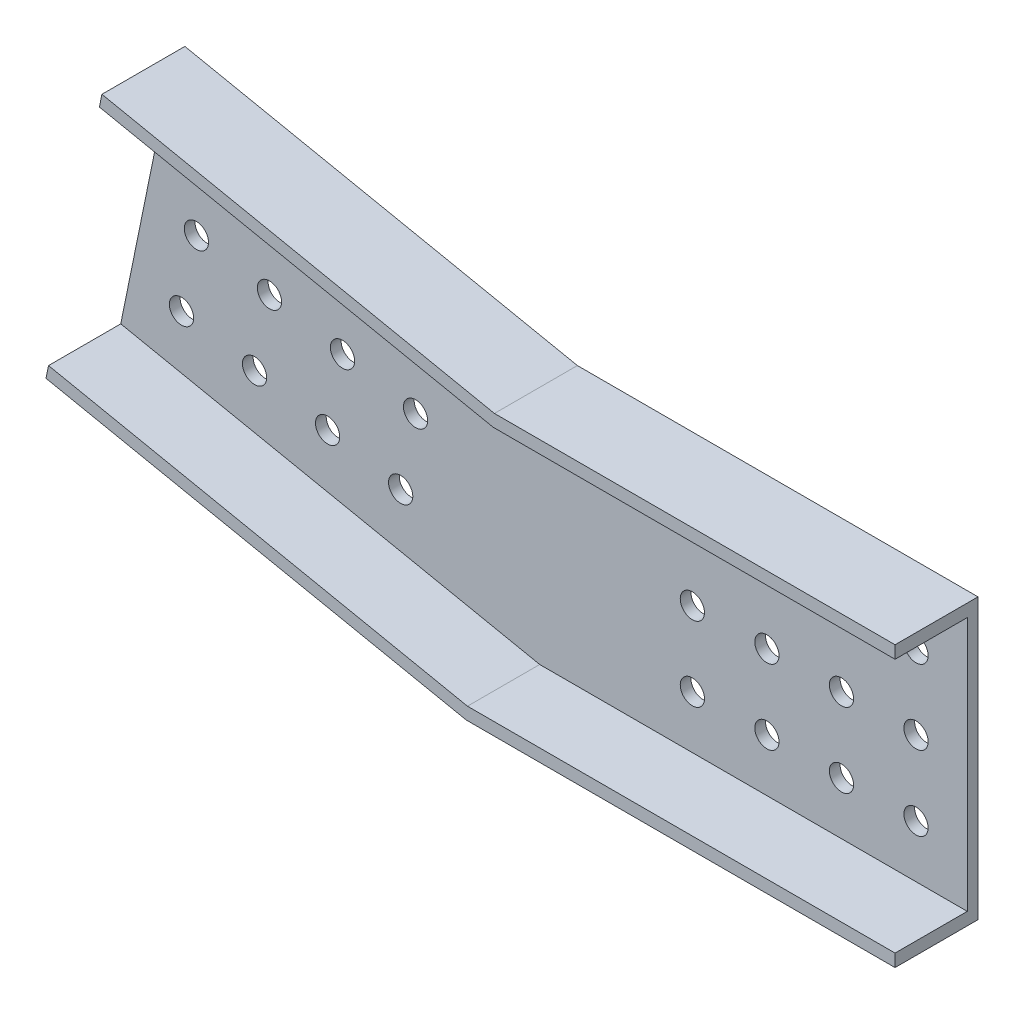
from build123d import *

# Parameters (mm, degrees)
EXTRUDE_1_DEPTH             = 89
CUT_EXTRUDE_1_DEPTH         = 77.5
SKETCH_4_R                  = 13
CUT_EXTRUDE_2_DEPTH         = 530.874608663
PATTERN_LINEAR_1_COUNT      = 4
PATTERN_LINEAR_1_PITCH      = 80
PATTERN_LINEAR_1_COUNT_DIR2 = 3
PATTERN_LINEAR_1_PITCH_DIR2 = 80
SKETCH_5_R                  = 13
CUT_EXTRUDE_3_DEPTH         = 530.874608663
PATTERN_LINEAR_2_COUNT      = 4
PATTERN_LINEAR_2_PITCH      = 80
PATTERN_LINEAR_2_COUNT_DIR2 = 3
PATTERN_LINEAR_2_PITCH_DIR2 = 80


with BuildPart() as part:
    # 草图2 → 凸台-拉伸1 (new body)
    with BuildSketch(Plane.XY):
        Polygon((15.153077165, 150), (445, 150), (445, -150), (-15.153077165, -150), (-466.009174215, -57.969384567), (-406.009174215, 235.969384567), align=None)
    extrude(amount=EXTRUDE_1_DEPTH)

    # 草图3 → 切除-拉伸1 (cut)
    with BuildSketch(Plane.XY.offset(89)):
        Polygon((-408.709174215, 222.742139956), (13.78930022, 136.5), (445, 136.5), (445, -136.5), (-13.78930022, -136.5), (-463.309174215, -44.742139956), align=None)
    extrude(amount=-CUT_EXTRUDE_1_DEPTH, mode=Mode.SUBTRACT)

    # 草图4 → 切除-拉伸2 (cut, through all)
    with BuildSketch(Plane(origin=(0, 0, 0), x_dir=(-1, 0, 0), z_dir=(0, 0, -1))):
        with Locations((-390, 80)):
            Circle(SKETCH_4_R)
    cut_extrude_2 = extrude(amount=-CUT_EXTRUDE_2_DEPTH, mode=Mode.SUBTRACT)

    # 阵列(线性)1: Cut-Extrude 2 4 × 3
    with Locations(*[(-i * PATTERN_LINEAR_1_PITCH, -j * PATTERN_LINEAR_1_PITCH_DIR2, 0) for i in range(PATTERN_LINEAR_1_COUNT) for j in range(PATTERN_LINEAR_1_COUNT_DIR2) if (i, j) != (0, 0)]):
        add(cut_extrude_2, mode=Mode.SUBTRACT)

    # 草图5 → 切除-拉伸3 (cut, through all)
    with BuildSketch(Plane(origin=(0, 0, 0), x_dir=(-1, 0, 0), z_dir=(0, 0, -1))):
        with Locations((366.120399874, 156.383671769)):
            Circle(SKETCH_5_R)
    cut_extrude_3 = extrude(amount=-CUT_EXTRUDE_3_DEPTH, mode=Mode.SUBTRACT)

    # 阵列(线性)2: Cut-Extrude 3 4 × 3
    with Locations(*[Vector(0.9797958971132713, -0.2000000000000002, 0) * (i * PATTERN_LINEAR_2_PITCH) + Vector(-0.20000000000000018, -0.9797958971132713, 0) * (j * PATTERN_LINEAR_2_PITCH_DIR2) for i in range(PATTERN_LINEAR_2_COUNT) for j in range(PATTERN_LINEAR_2_COUNT_DIR2) if (i, j) != (0, 0)]):
        add(cut_extrude_3, mode=Mode.SUBTRACT)


solid = part.part
